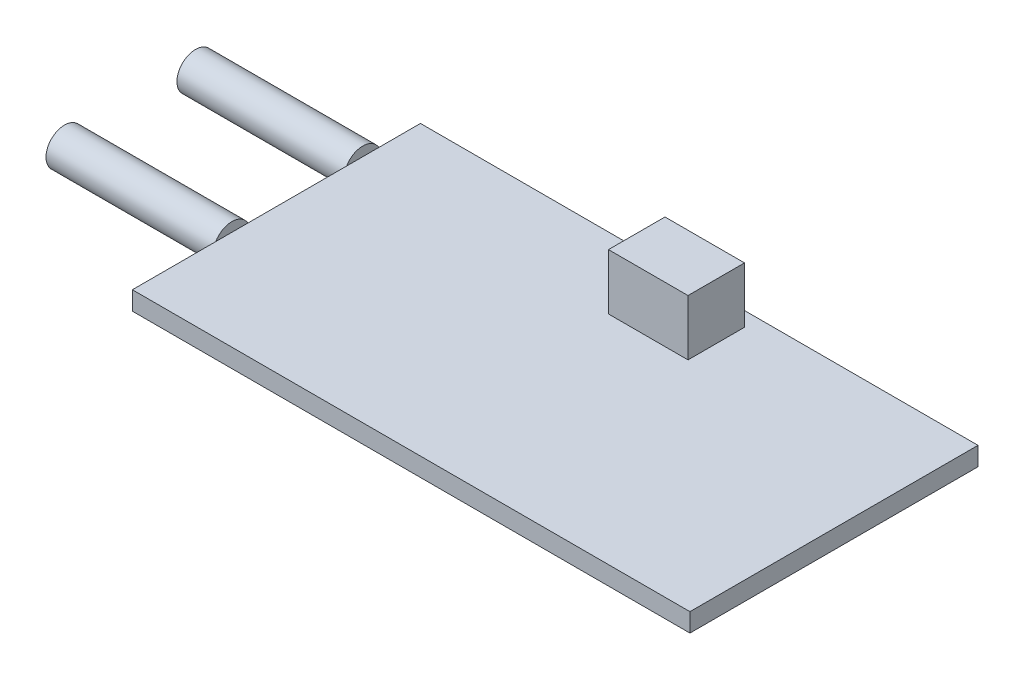
from build123d import *

# Parameters (mm, degrees)
SKETCH1_W           = 30
SKETCH1_H           = 15.5
BOSS_EXTRUDE1_DEPTH = 1
SKETCH2_R           = 1
BOSS_EXTRUDE2_DEPTH = 9
SKETCH3_W           = 4.279397372
SKETCH3_H           = 3.040773008
BOSS_EXTRUDE3_DEPTH = 3


with BuildPart() as part:
    # Sketch1 → Boss-Extrude1 (new body)
    with BuildSketch(Plane(origin=(0, 0, 0), x_dir=(1, 0, 0), z_dir=(0, 1, 0))):
        with Locations((1.743407461, -3.928718986)):
            Rectangle(SKETCH1_W, SKETCH1_H)
    extrude(amount=BOSS_EXTRUDE1_DEPTH)

    # Sketch2 → Boss-Extrude2 (add)
    with BuildSketch(Plane.ZY.offset(13.256592539)):
        with Locations(Location((-0.717776519, 0.5, 0), (0, 0, 150))):
            Circle(SKETCH2_R)
        with Locations(Location((6.326509059, 0.5, 0), (0, 0, 150))):
            Circle(SKETCH2_R)
    extrude(amount=BOSS_EXTRUDE2_DEPTH)

    # Sketch3 → Boss-Extrude3 (add)
    with BuildSketch(Plane(origin=(0, 1, 0), x_dir=(1, 0, 0), z_dir=(0, 1, 0))):
        with Locations((2.821431472, 1.520386504)):
            Rectangle(SKETCH3_W, SKETCH3_H)
    extrude(amount=BOSS_EXTRUDE3_DEPTH)


solid = part.part
